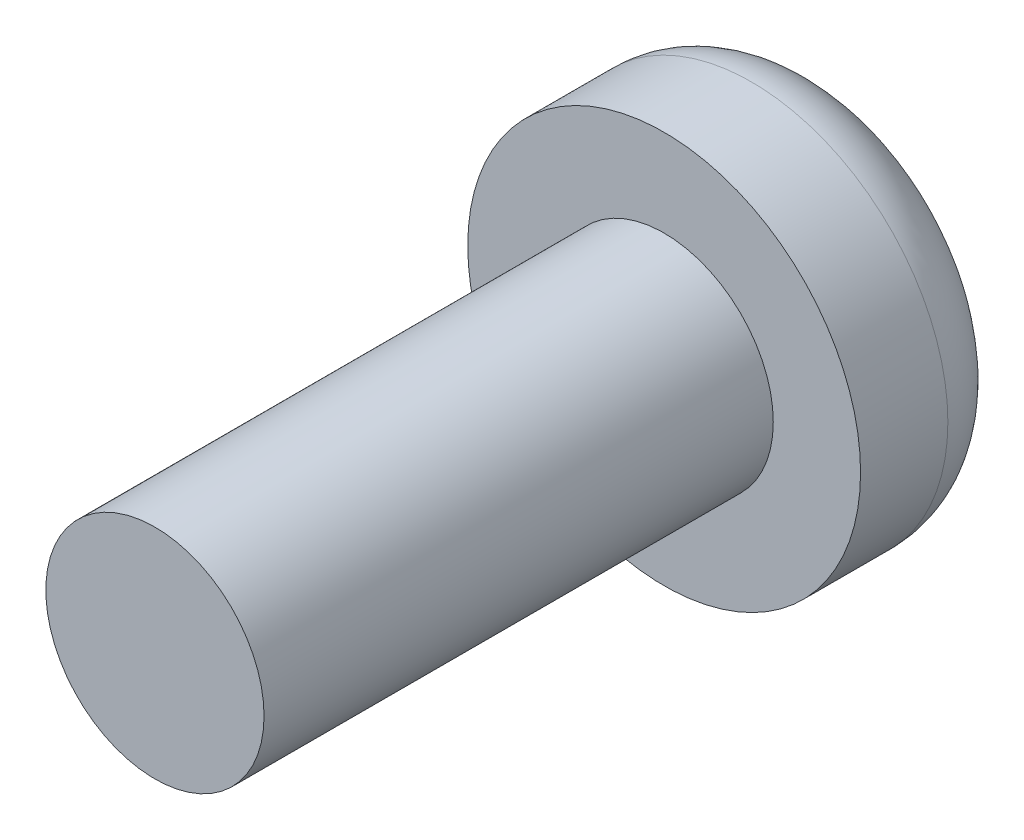
from build123d import *

# Parameters (mm, degrees)
SKETCH_1_R      = 1.5
EXTRUDE_1_DEPTH = 7
SKETCH_2_R      = 2.7
EXTRUDE_2_DEPTH = 2.2
FILLET_1_R      = 1


with BuildPart() as part:
    # 草图1 → 凸台-拉伸1 (new body)
    with BuildSketch(Plane.XY):
        Circle(SKETCH_1_R)
    extrude(amount=EXTRUDE_1_DEPTH)

    # 草图2 → 凸台-拉伸2 (add)
    with BuildSketch(Plane(origin=(0, 0, 0), x_dir=(-1, 0, 0), z_dir=(0, 0, -1))):
        Circle(SKETCH_2_R)
    extrude(amount=EXTRUDE_2_DEPTH)

    # 圆角1
    fillet_1_edges = [part.edges().sort_by_distance(p)[0] for p in [
        (2.7, 0, -2.2),
    ]]
    fillet(fillet_1_edges, radius=FILLET_1_R)


solid = part.part
